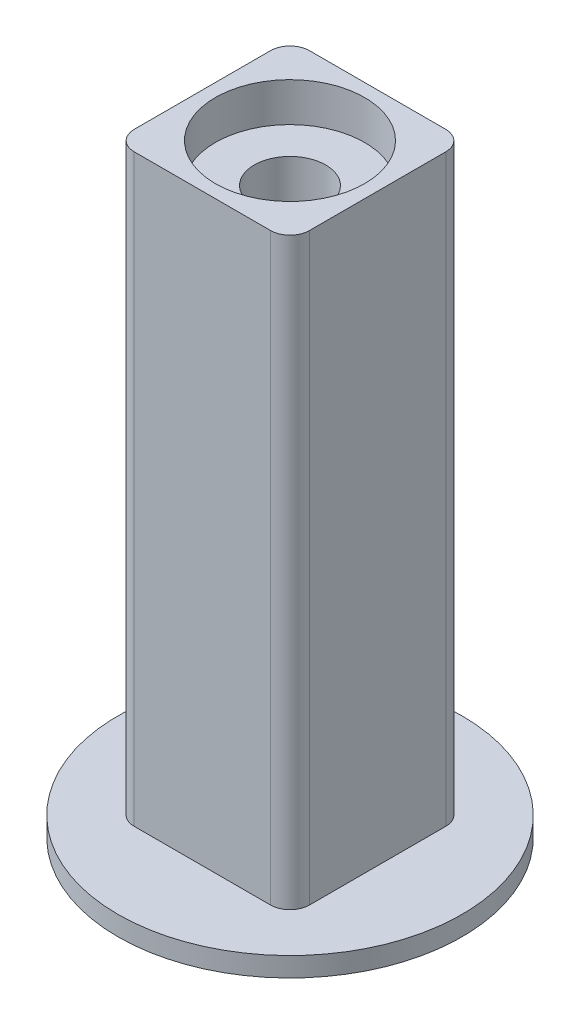
from build123d import *

# Parameters (mm, degrees)
SKETCH1_R           = 26.5
BOSS_EXTRUDE1_DEPTH = 3
SKETCH10_W          = 27
SKETCH10_H          = 27
BOSS_EXTRUDE6_DEPTH = 90
SKETCH11_R          = 5.5
CUT_EXTRUDE3_DEPTH  = 90
SKETCH12_R          = 11.5
CUT_EXTRUDE4_DEPTH  = 6
FILLET2_R           = 3


with BuildPart() as part:
    # Sketch1 → Boss-Extrude1 (new body)
    with BuildSketch(Plane(origin=(0, 0, 0), x_dir=(1, 0, 0), z_dir=(0, 1, 0))):
        with Locations(Location((0, 0, 0), (0, 0, 270))):
            Circle(SKETCH1_R)
    extrude(amount=BOSS_EXTRUDE1_DEPTH)

    # Sketch10 → Boss-Extrude6 (add)
    with BuildSketch(Plane(origin=(0, 3, 0), x_dir=(1, 0, 0), z_dir=(0, 1, 0))):
        Rectangle(SKETCH10_W, SKETCH10_H)
    extrude(amount=BOSS_EXTRUDE6_DEPTH)

    # Sketch11 → Cut-Extrude3 (cut)
    with BuildSketch(Plane(origin=(0, 93, 0), x_dir=(1, 0, 0), z_dir=(0, 1, 0))):
        with Locations(Location((0, 0, 0), (0, 0, 270))):
            Circle(SKETCH11_R)
    extrude(amount=-CUT_EXTRUDE3_DEPTH, mode=Mode.SUBTRACT)

    # Sketch12 → Cut-Extrude4 (cut)
    with BuildSketch(Plane(origin=(0, 93, 0), x_dir=(1, 0, 0), z_dir=(0, 1, 0))):
        with Locations(Location((0, 0, 0), (0, 0, 270))):
            Circle(SKETCH12_R)
    extrude(amount=-CUT_EXTRUDE4_DEPTH, mode=Mode.SUBTRACT)

    # Fillet2
    fillet2_edges = [part.edges().sort_by_distance(p)[0] for p in [
        (13.5, 48, 13.5),
        (13.5, 48, -13.5),
        (-13.5, 48, -13.5),
        (-13.5, 48, 13.5),
    ]]
    fillet(fillet2_edges, radius=FILLET2_R)


solid = part.part
